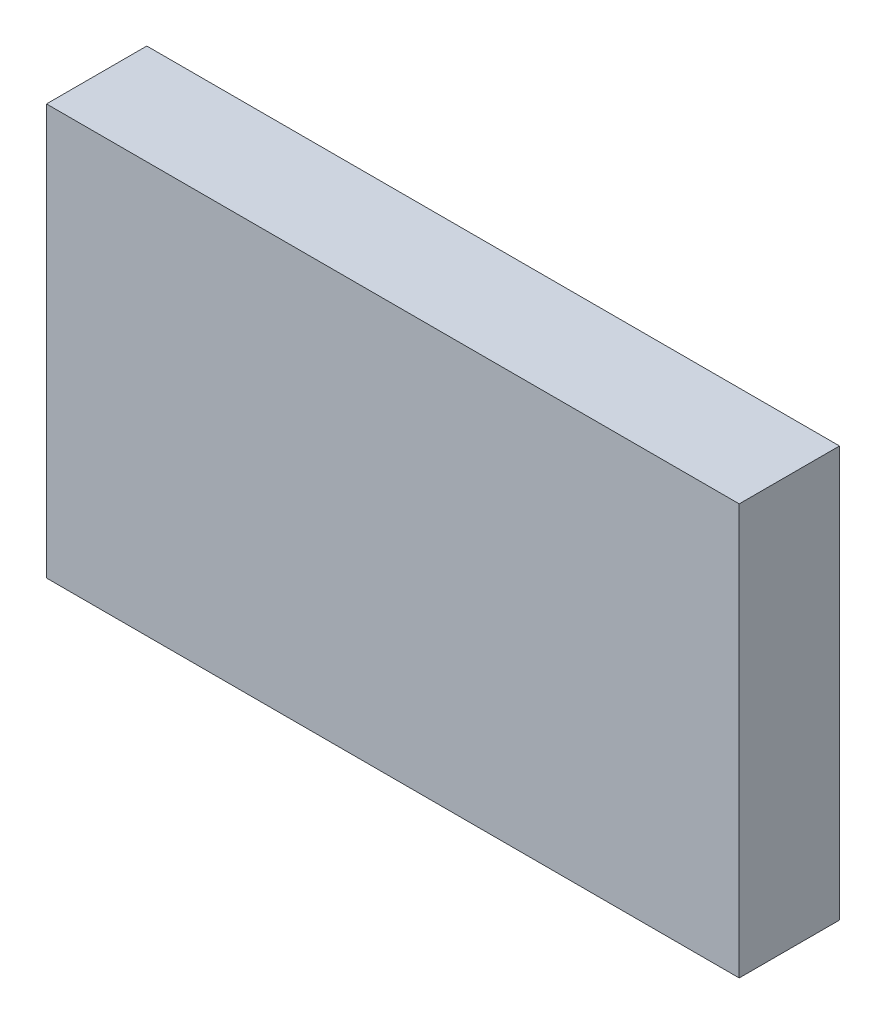
from build123d import *

# Parameters (mm, degrees)
CROQUIS1_W              = 22.1
CROQUIS1_H              = 13.1
SALIENTE_EXTRUIR1_DEPTH = 3.2


with BuildPart() as part:
    # Croquis1 → Saliente-Extruir1 (new body)
    with BuildSketch(Plane.XY):
        Rectangle(CROQUIS1_W, CROQUIS1_H)
    extrude(amount=SALIENTE_EXTRUIR1_DEPTH)


solid = part.part
